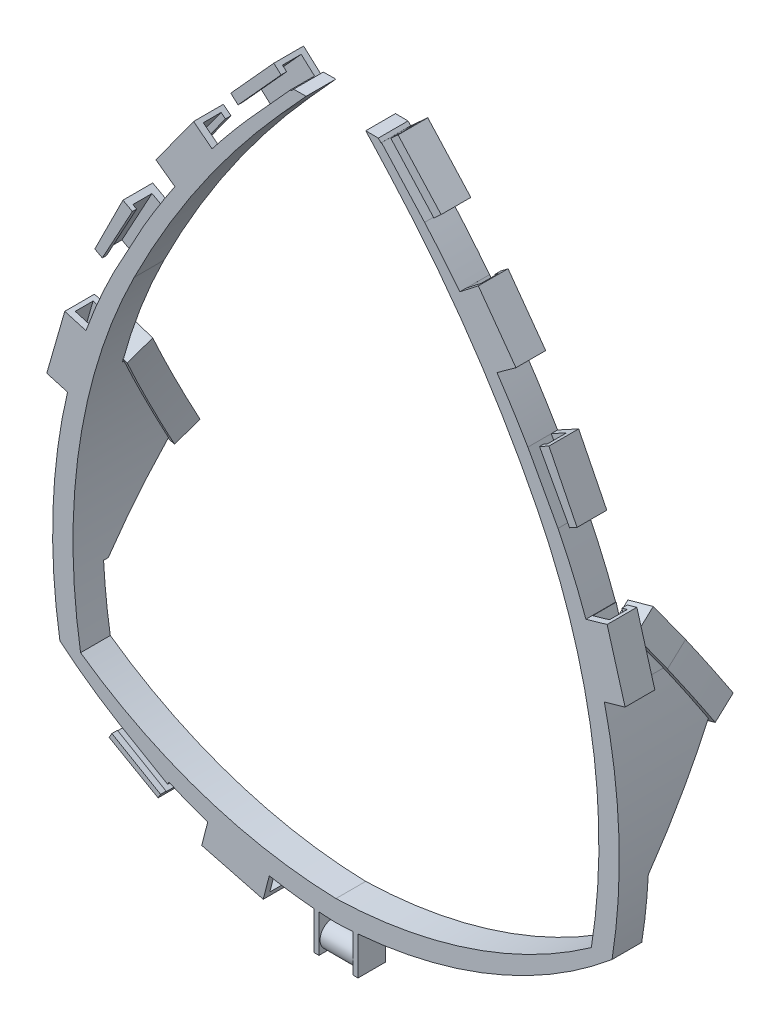
from build123d import *

# Parameters (mm, degrees)
BOSS_EXTRUDE1_DEPTH  = 7
BOSS_EXTRUDE2_DEPTH  = 7
CUT_EXTRUDE1_DEPTH   = 15.328126255
CUT_EXTRUDE2_REACH   = 138.44
CUT_EXTRUDE3_REACH   = 141.61
CUT_EXTRUDE4_DEPTH   = 15.092193544
SKETCH8_W            = 1.2
SKETCH8_H            = 10.817487092
BOSS_EXTRUDE3_DEPTH  = 6.5
SKETCH9_R            = 3
BOSS_EXTRUDE4_DEPTH  = 8
BOSS_EXTRUDE5_START  = 15.1
BOSS_EXTRUDE5_DEPTH  = 15.1
CUT_EXTRUDE7_DEPTH   = 15.1
BOSS_EXTRUDE10_DEPTH = 6
SKETCH15_R           = 2
CUT_EXTRUDE10_DEPTH  = 6
BOSS_EXTRUDE11_START = 15.1
BOSS_EXTRUDE11_DEPTH = 15.1
CUT_EXTRUDE17_DEPTH  = 15.1
BOSS_EXTRUDE12_DEPTH = 6
SKETCH27_R           = 2
CUT_EXTRUDE18_DEPTH  = 6
BOSS_EXTRUDE13_DEPTH = 7
CUT_EXTRUDE20_REACH  = 163.243
CUT_EXTRUDE21_DEPTH  = 14.958754623


with BuildPart() as part:
    # Sketch1 → Boss-Extrude1 (new body)
    with BuildSketch(Plane.XY):
        with BuildLine():
            Line((-7.021615028, 140), (-12.826681625, 133.573929175))
            ThreePointArc((-12.826681625, 133.573929175), (-31.885148435, 109.37457248), (-47.51005812, 82.82845753))
            ThreePointArc((-47.51005812, 82.82845753), (-60.358800988, 42.410481393), (-60.126300812, 0))
            ThreePointArc((-60.126300812, 0), (-31.547124131, -14.479791837), (0, -20.066621923))
            ThreePointArc((0, -20.066621923), (31.547124131, -14.479791837), (60.126300812, 0))
            ThreePointArc((60.126300812, 0), (60.358800988, 42.410481393), (47.51005812, 82.82845753))
            ThreePointArc((47.51005812, 82.82845753), (31.885148435, 109.37457248), (12.826681625, 133.573929175))
            Line((12.826681625, 133.573929175), (7.021615028, 140))
            Line((7.021615028, 140), (9.968842506, 139.969818115))
            Line((9.968842506, 139.969818115), (14.596413116, 135.085455317))
            ThreePointArc((14.596413116, 135.085455317), (34.556445217, 110.988389257), (50.852748871, 84.276931763))
            ThreePointArc((50.852748871, 84.276931763), (64.864103815, 43.303076383), (65, 0))
            ThreePointArc((65, 0), (34.590156597, -17.933007584), (0, -24.995047191))
            ThreePointArc((0, -24.995047191), (-34.590156597, -17.933007584), (-65, 0))
            ThreePointArc((-65, 0), (-64.864103815, 43.303076383), (-50.852748871, 84.276931763))
            ThreePointArc((-50.852748871, 84.276931763), (-34.556445217, 110.988389257), (-14.596413116, 135.085455317))
            Line((-14.596413116, 135.085455317), (-9.968842506, 139.969818115))
            Line((-9.968842506, 139.969818115), (-7.021615028, 140))
        make_face()
    extrude(amount=BOSS_EXTRUDE1_DEPTH)

    # Sketch2 → Boss-Extrude2 (add)
    with BuildSketch(Plane.XY.offset(7)):
        Polygon((10.598690104, 139.305019146), (20.734100342, 128.122543335), (24.75810831, 131.769765314), (14.622698071, 142.952241125), align=None)
        Polygon((28.767629653, 117.918538074), (33.521362618, 121.617731328), (42.38007548, 109.356864001), (37.208326557, 105.620175765), align=None)
        Polygon((45.189820482, 94.573419922), (52.274842074, 81.552945809), (56.767027693, 83.997344671), (50.141001873, 97.267578887), align=None)
        Polygon((58.083022165, 66.088853155), (63.847934328, 67.744124964), (68.078156678, 53.011281608), (62.313244515, 51.356009799), align=None)
    boss_extrude2 = extrude(amount=-BOSS_EXTRUDE2_DEPTH)

    # Sketch4 → Cut-Extrude1 (cut)
    with BuildSketch(Plane(origin=(-8.876681223, 30.915338052, 0), x_dir=(0.9611640138638262, 0.27597778615892016, 0), z_dir=(0.2759777861589201, -0.9611640138638261, 0))):
        Polygon((74.985471844, 5.5), (79.064210469, 5.5), (79.064210469, 1.3), (77.731086981, 1.3), (77.731086981, 0), (74.985471844, 0), (74.985471844, 1.3), align=None)
    cut_extrude1 = extrude(amount=-CUT_EXTRUDE1_DEPTH, mode=Mode.SUBTRACT)

    # Cut-Extrude2: up to this face of the body (flat: up to its plane)
    cut_extrude2_end = Plane(part.part.faces().sort_by_distance((47.665411177, 95.920499404, 3.5))[0])
    # Sketch5 → Cut-Extrude2 (cut, up to the picked face)
    with BuildSketch(Plane(origin=(-22.296513067, 40.975340359, 0), x_dir=(0.8783788027737591, 0.4779651439568973, 0), z_dir=(0.4779651439568973, -0.8783788027737591, 0)), mode=Mode.PRIVATE) as cut_extrude2_sk1:
        Polygon((88.01075676, 6), (89.01075676, 6), (89.01075676, 1.5), (84.89657868, 1.5), (84.89657868, 6), (84.89657868, 7), (88.01075676, 7), align=None)
    cut_extrude2_tool1 = split(extrude(cut_extrude2_sk1.sketch, amount=-CUT_EXTRUDE2_REACH, mode=Mode.PRIVATE), bisect_by=cut_extrude2_end, keep=Keep.BOTH, mode=Mode.PRIVATE)
    cut_extrude2 = cut_extrude2_tool1.solids().sort_by(Axis((54.018507, 82.501752, 4.145968), (-0.4779651439568973, 0.8783788027737591, 0)))[0]
    add(cut_extrude2, mode=Mode.SUBTRACT)

    # Cut-Extrude3: up to this plane
    cut_extrude3_end = Plane(origin=(28.767629653, 117.918538074, -21.00524852), z_dir=(-0.6141314862250209, 0.7892037237792578, 0))
    # Sketch6 → Cut-Extrude3 (cut, up to the surface)
    with BuildSketch(Plane(origin=(-37.376690422, 51.731064035, 0), x_dir=(0.8105649310796583, 0.5856487791362917, 0), z_dir=(0.5856487791362915, -0.8105649310796582, 0)), mode=Mode.PRIVATE) as cut_extrude3_sk1:
        Polygon((92.895499442, 5.5), (97.396516853, 5.5), (97.396516853, 1.3), (96.096516853, 1.3), (96.096516853, 0), (92.895499442, 0), (92.895499442, 1.3), align=None)
    cut_extrude3_tool1 = split(extrude(cut_extrude3_sk1.sketch, amount=-CUT_EXTRUDE3_REACH, mode=Mode.PRIVATE), bisect_by=cut_extrude3_end, keep=Keep.BOTH, mode=Mode.PRIVATE)
    cut_extrude3 = cut_extrude3_tool1.solids().sort_by_distance((39.650274, 107.38453, 2.903866))[0]
    add(cut_extrude3, mode=Mode.SUBTRACT)

    # Sketch7 → Cut-Extrude4 (cut)
    with BuildSketch(Plane(origin=(-54.401816303, 60.021940955, 0), x_dir=(0.7409443682623981, 0.671566410074414, 0), z_dir=(0.671566410074414, -0.7409443682623981, 0))):
        Polygon((104.536529169, 5.7), (105.836529169, 5.7), (105.836529169, 1.3), (101.590593152, 1.3), (101.590593152, 5.7), (101.590593152, 7), (104.536529169, 7), align=None)
    cut_extrude4 = extrude(amount=-CUT_EXTRUDE4_DEPTH, mode=Mode.SUBTRACT)

    # Mirror2: Boss-Extrude2, Cut-Extrude1, Cut-Extrude2, Cut-Extrude3, Cut-Extrude4 across plane
    add(boss_extrude2.mirror(Plane(origin=(0, 0, 0), x_dir=(0, 0, 1), z_dir=(1, 0, 0))))
    add(cut_extrude1.mirror(Plane(origin=(0, 0, 0), x_dir=(0, 0, 1), z_dir=(1, 0, 0))), mode=Mode.SUBTRACT)
    add(cut_extrude2.mirror(Plane(origin=(0, 0, 0), x_dir=(0, 0, 1), z_dir=(1, 0, 0))), mode=Mode.SUBTRACT)
    add(cut_extrude3.mirror(Plane(origin=(0, 0, 0), x_dir=(0, 0, 1), z_dir=(1, 0, 0))), mode=Mode.SUBTRACT)
    add(cut_extrude4.mirror(Plane(origin=(0, 0, 0), x_dir=(0, 0, 1), z_dir=(1, 0, 0))), mode=Mode.SUBTRACT)

    # Sketch8 → Boss-Extrude3 (add)
    with BuildSketch(Plane.XY.offset(7)):
        with Locations((-4.6, -28.25536073)):
            Rectangle(SKETCH8_W, SKETCH8_H)
        with Locations((4.6, -28.25536073)):
            Rectangle(SKETCH8_W, SKETCH8_H)
    extrude(amount=-BOSS_EXTRUDE3_DEPTH)

    # Sketch9 → Boss-Extrude4 (add)
    with BuildSketch(Plane.ZY.offset(-4)):
        with Locations(Location((3.75, -30.664104276, 0), (0, 0, 270))):
            Circle(SKETCH9_R)
    extrude(amount=BOSS_EXTRUDE4_DEPTH)

    # Sketch11 → Boss-Extrude5 (add)
    with BuildSketch(Plane(origin=(0, 0, 0), x_dir=(-1, 0, 0), z_dir=(0, 0, -1)).offset(BOSS_EXTRUDE5_START)):
        with BuildLine():
            ThreePointArc((57.25533927, 57.204192784), (61.174267393, 36.053346366), (61.70762581, 14.549118162))
            Line((61.70762581, 14.549118162), (66.53516265, 14.549118162))
            ThreePointArc((66.53516265, 14.549118162), (66.16565981, 33.196475152), (63.196655876, 51.609662566))
            Line((63.196655876, 51.609662566), (61.081544701, 58.976084244))
            Line((61.081544701, 58.976084244), (57.25533927, 57.204192784))
        make_face()
    extrude(amount=-BOSS_EXTRUDE5_DEPTH)

    # Sketch12 → Cut-Extrude7 (cut)
    with BuildSketch(Plane(origin=(-72.073337099, 20.694324514, 0), x_dir=(0, 0, 1), z_dir=(-0.9611640138638261, 0.2759777861589201, 0))):
        Polygon((-15.1, 13.893169583), (-4.462143771, 32.164477244), (-15.1, 32.164477244), align=None)
        Polygon((-4.462143771, 32.164477244), (0, 39.828540372), (-15.1, 39.828540372), (-15.1, 32.164477244), align=None)
        Polygon((-15.1, 13.893169583), (-16.783863544, -4.378138079), (0, -4.378138079), align=None)
    extrude(amount=-CUT_EXTRUDE7_DEPTH, mode=Mode.SUBTRACT)

    # Sketch23 → Boss-Extrude11 (add)
    with BuildSketch(Plane(origin=(0, 0, 0), x_dir=(-1, 0, 0), z_dir=(0, 0, -1)).offset(BOSS_EXTRUDE11_START)):
        with BuildLine():
            Line((-61.081544701, 58.976084244), (-63.196655876, 51.609662566))
            ThreePointArc((-63.196655876, 51.609662566), (-66.16565981, 33.196475152), (-66.53516265, 14.549118162))
            Line((-66.53516265, 14.549118162), (-61.70762581, 14.549118162))
            ThreePointArc((-61.70762581, 14.549118162), (-61.137624755, 36.400093161), (-57.072711228, 57.877208602))
            Line((-57.072711228, 57.877208602), (-61.081544701, 58.976084244))
        make_face()
    extrude(amount=-BOSS_EXTRUDE11_DEPTH)

    # Sketch25 → Cut-Extrude17 (cut)
    with BuildSketch(Plane(origin=(72.073337099, 20.694324514, 0), x_dir=(0, 0, -1), z_dir=(0.9611640138638262, 0.2759777861589202, 0))):
        Polygon((15.1, 43.361210289), (0, 43.361210289), (2.176172337, 39.828540372), (15.1, 39.828540372), align=None)
        Polygon((15.1, 39.828540372), (2.176172337, 39.828540372), (6.897338639, 32.164477244), (15.1, 32.164477244), align=None)
        Polygon((15.1, 32.164477244), (6.897338639, 32.164477244), (15.1, 18.848760222), align=None)
        Polygon((0, -4.378138079), (15.1, -4.378138079), (15.1, 18.848760222), align=None)
    extrude(amount=-CUT_EXTRUDE17_DEPTH, mode=Mode.SUBTRACT)

    # Sketch26 → Boss-Extrude12 (add)
    with BuildSketch(Plane(origin=(-3.291871595, 11.464794175, -19.363262572), x_dir=(-0.9894687847872679, -0.07374573277223682, 0.12455155892036585), z_dir=(-0.14474641249995637, 0.5041168159481243, -0.851419233953942))):
        with BuildLine():
            Line((-70.702823545, 24.6228851), (-64.145639982, 23.019870704))
            add(Edge.make_bspline(
                [(-64.145639982, 23.019870704), (-63.33661146, 31.937769795), (-61.886133167, 40.750291903), (-59.802274655, 49.458762687)],
                knots=[0, 0, 0, 0, 1, 1, 1, 1], degree=3))
            Line((-59.802274655, 49.458762687), (-65.795823717, 50.834286808))
            Line((-65.795823717, 50.834286808), (-68.172599637, 41.112006065))
            add(Edge.make_bspline(
                [(-68.172599637, 41.112006065), (-69.265071066, 35.653850719), (-70.109220735, 30.157590876), (-70.702823545, 24.6228851)],
                knots=[0, 0, 0, 0, 1, 1, 1, 1], degree=3))
        make_face()
    extrude(amount=BOSS_EXTRUDE12_DEPTH)

    # Sketch27 → Cut-Extrude18 (cut)
    with BuildSketch(Plane(origin=(-1.674994728, 5.833602328, 3.738776835), x_dir=(0.9720019472606173, 0.19782966138524236, 0.12678974563334638), z_dir=(0.23497279527972664, -0.8183535283880368, -0.5244857367491345))):
        with Locations(Location((66.525645084, -36.051026672, 0), (0, 0, 270))):
            Circle(SKETCH27_R)
    extrude(amount=-CUT_EXTRUDE18_DEPTH, mode=Mode.SUBTRACT)

    # Sketch28 → Boss-Extrude13 (add)
    with BuildSketch(Plane.XY.offset(7)):
        Polygon((-50.076049805, -8.208926201), (-53.397716522, -13.904776573), (-41.873111725, -20.47215271), (-38.401283264, -14.416573524), align=None)
        Polygon((-29.899793392, -18.458172074), (-31.605949535, -25.026873225), (-17.127614719, -28.78747967), (-15.421458576, -22.21877852), align=None)
    extrude(amount=-BOSS_EXTRUDE13_DEPTH)

    # Cut-Extrude20: up to this plane
    cut_extrude20_end = Plane(origin=(-41.873111725, -20.47215271, -19.372138108), z_dir=(0.8675327121236479, -0.49738012967486744, 0))
    # Sketch29 → Cut-Extrude20 (cut, up to the surface)
    with BuildSketch(Plane(origin=(-33.795338863, 19.708532523, 0), x_dir=(0, 0, 1), z_dir=(-0.8638391379626135, 0.5037677478005207, 0)), mode=Mode.PRIVATE) as cut_extrude20_sk1:
        Polygon((1.3, -34.291888865), (5.7, -34.291888865), (7, -34.291888865), (7, -37.611537599), (5.7, -37.611537599), (5.7, -37.911537599), (1.3, -37.911537599), align=None)
    cut_extrude20_tool1 = split(extrude(cut_extrude20_sk1.sketch, amount=-CUT_EXTRUDE20_REACH, mode=Mode.PRIVATE), bisect_by=cut_extrude20_end, keep=Keep.BOTH, mode=Mode.PRIVATE)
    add(cut_extrude20_tool1.solids().sort_by_distance((-51.966107, -11.449915, 4.107613))[0], mode=Mode.SUBTRACT)

    # Sketch30 → Cut-Extrude21 (cut)
    with BuildSketch(Plane(origin=(-23.518769162, 6.108771211, 0), x_dir=(0, 0, 1), z_dir=(-0.9678837029207193, 0.2513983643949916, 0))):
        Polygon((5.7, -26.479571697), (1.3, -26.479571697), (0, -26.479571697), (0, -29.868786748), (1.3, -29.868786748), (1.3, -31.168786748), (5.7, -31.168786748), align=None)
    extrude(amount=-CUT_EXTRUDE21_DEPTH, mode=Mode.SUBTRACT)


with BuildPart() as body_2:
    # Sketch13 → Boss-Extrude10 (new body)
    with BuildSketch(Plane(origin=(2.782689127, 9.691434545, -17.318332702), x_dir=(-0.9903122435485969, 0.06781029820745549, -0.12117517788210853), z_dir=(0.13885841810183738, 0.48361035269950303, -0.8641986846114253))):
        with BuildLine():
            Line((67.600524236, 43.078270032), (65.171580524, 52.867019773))
            Line((65.171580524, 52.867019773), (59.463088047, 50.310605567))
            add(Edge.make_bspline(
                [(59.463088047, 50.310605567), (60.669659326, 45.224262066), (61.651906681, 40.104883363), (63.170689985, 29.800487991), (63.707245304, 24.615474175), (64.015620321, 19.396857245)],
                knots=[0, 0, 0, 0, 0.5, 0.5, 1, 1, 1, 1], degree=3))
            Line((64.015620321, 19.396857245), (70.662832093, 21.046271487))
            add(Edge.make_bspline(
                [(70.662832093, 21.046271487), (70.101936856, 28.454190574), (69.079158289, 35.797910812), (67.600524236, 43.078270032)],
                knots=[0, 0, 0, 0, 1, 1, 1, 1], degree=3))
        make_face()
    extrude(amount=BOSS_EXTRUDE10_DEPTH)

    # Sketch15 → Cut-Extrude10 (cut)
    with BuildSketch(Plane(origin=(0.813017417, 2.831543419, 1.715181995), x_dir=(0.9711425857331994, -0.20399326632213383, -0.12356708894629877), z_dir=(-0.23849963978051525, -0.8306366764769557, -0.5031507065640292))):
        with Locations(Location((-66.211300138, -32.844432713, 0), (0, 0, 270))):
            Circle(SKETCH15_R)
    extrude(amount=-CUT_EXTRUDE10_DEPTH, mode=Mode.SUBTRACT)


solid = Compound([part.part, body_2.part])
